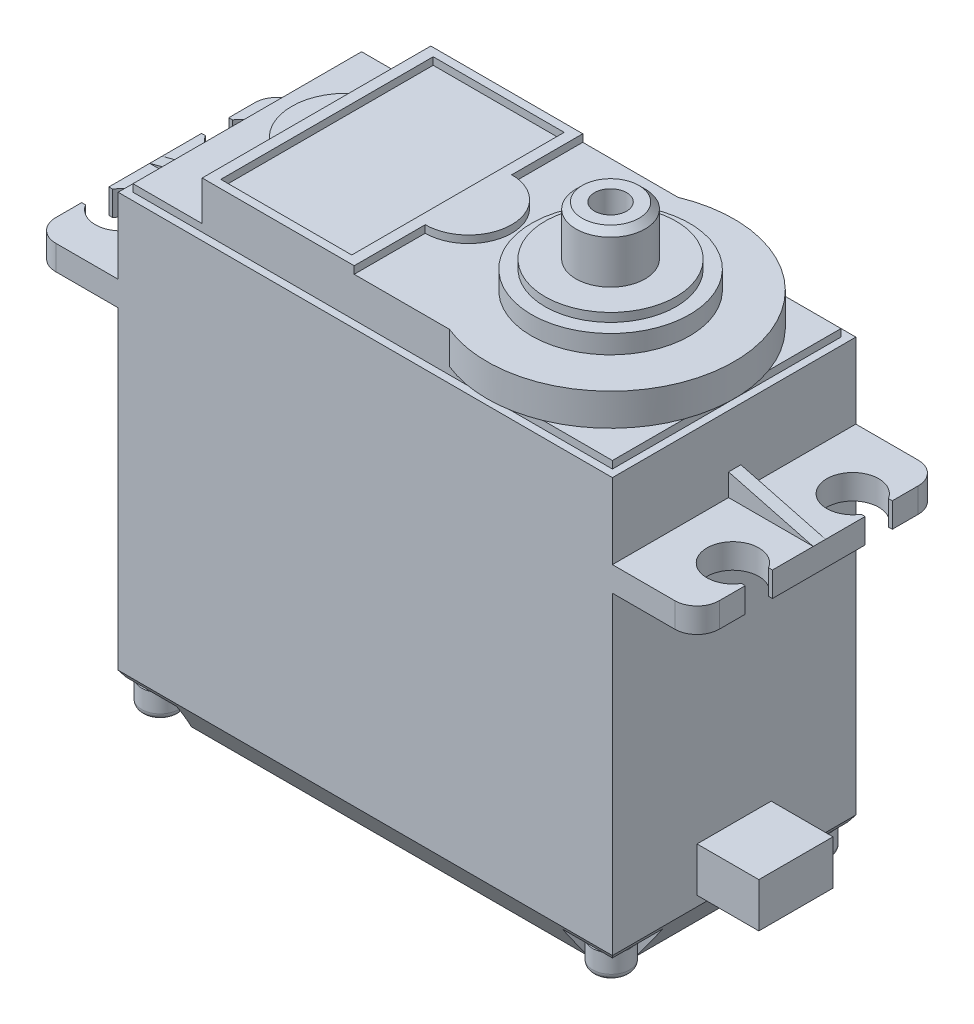
from build123d import *

# Parameters (mm, degrees)
SKETCH1_W            = 40
SKETCH1_H            = 36.5
BOSS_EXTRUDE1_DEPTH  = 19.7
CHAMFER1_SIZE        = 2
CHAMFER1_SIZE2       = 3
CUT_EXTRUDE1_DEPTH   = 2.5
SKETCH4_R            = 1.5
BOSS_EXTRUDE2_DEPTH  = 2
FILLET1_R            = 0.5
FILLET3_R            = 0.5
FILLET4_R            = 0.5
FILLET5_R            = 0.5
SKETCH5_W            = 53.7
SKETCH5_H            = 19.7
BOSS_EXTRUDE3_DEPTH  = 2
CUT_EXTRUDE2_DEPTH   = 2
FILLET9_R            = 1.8
BOSS_EXTRUDE4_DEPTH  = 1
SKETCH8_W            = 38.8
SKETCH8_H            = 18.5
BOSS_EXTRUDE5_DEPTH  = 0.6
BOSS_EXTRUDE6_DEPTH  = 2.6
SKETCH10_W           = 10.6
SKETCH10_H           = 17.190691902
BOSS_EXTRUDE7_DEPTH  = 0.6
SKETCH11_R           = 6.4
BOSS_EXTRUDE8_DEPTH  = 1.5
SKETCH12_R           = 5.3
BOSS_EXTRUDE9_DEPTH  = 0.7
SKETCH13_R           = 2.8
SKETCH13_R_2         = 1.3
BOSS_EXTRUDE10_DEPTH = 4
CHAMFER2_SIZE        = 0.5
CUT_EXTRUDE3_DEPTH   = 1.2
LPATTERN1_COUNT      = 2
LPATTERN1_PITCH      = 36.5
LPATTERN1_COUNT_DIR2 = 2
LPATTERN1_PITCH_DIR2 = 16.3
SKETCH16_W           = 6
SKETCH16_H           = 3.6
BOSS_EXTRUDE11_DEPTH = 5


with BuildPart() as part:
    # Sketch1 → Boss-Extrude1 (new body)
    with BuildSketch(Plane.XY):
        Rectangle(SKETCH1_W, SKETCH1_H)
    extrude(amount=BOSS_EXTRUDE1_DEPTH)

    # Chamfer1
    chamfer1_edges = [part.edges().sort_by_distance(p)[0] for p in [
        (0, -18.25, 19.7),
        (0, -18.25, 0),
        (20, -18.25, 9.85),
        (-20, -18.25, 9.85),
    ]]
    chamfer1_side = [part.faces().sort_by_distance(p)[0] for p in [
        (0, -18.25, 9.85),
    ]]
    chamfer(chamfer1_edges, length=CHAMFER1_SIZE, length2=CHAMFER1_SIZE2, reference=chamfer1_side[0])

    # Sketch2 → Cut-Extrude1 (cut)
    with BuildSketch(Plane.XZ.offset(18.25)):
        with BuildLine():
            Line((20, 15.3), (20, 19.7))
            Line((20, 19.7), (15.6, 19.7))
            ThreePointArc((15.6, 19.7), (16.888730163, 16.588730163), (20, 15.3))
        make_face()
        with BuildLine():
            Line((20, 4.4), (20, 0))
            Line((20, 0), (15.6, 0))
            ThreePointArc((15.6, 0), (16.888730163, 3.111269837), (20, 4.4))
        make_face()
        with BuildLine():
            Line((-15.6, 0), (-20, 0))
            Line((-20, 0), (-20, 4.4))
            ThreePointArc((-20, 4.4), (-16.888730163, 3.111269837), (-15.6, 0))
        make_face()
        with BuildLine():
            Line((-20, 15.3), (-20, 19.7))
            Line((-20, 19.7), (-15.6, 19.7))
            ThreePointArc((-15.6, 19.7), (-16.888730163, 16.588730163), (-20, 15.3))
        make_face()
    extrude(amount=-CUT_EXTRUDE1_DEPTH, mode=Mode.SUBTRACT)

    # Sketch4 → Boss-Extrude2 (add)
    with BuildSketch(Plane.XZ.offset(15.75)):
        with Locations(Location((18.20504142, 18.001219169, 0), (0, 0, 114.453388665))):
            Circle(SKETCH4_R)
        with Locations(Location((18.20504142, 1.751219169, 0), (0, 0, 250.954058998))):
            Circle(SKETCH4_R)
        with Locations(Location((-18.29495858, 1.751219169, 0), (0, 0, 203.869136849))):
            Circle(SKETCH4_R)
        with Locations(Location((-18.29495858, 18.001219169, 0), (0, 0, 156.130863151))):
            Circle(SKETCH4_R)
    extrude(amount=BOSS_EXTRUDE2_DEPTH)

    # Fillet1
    fillet1_edges = [part.edges().sort_by_distance(p)[0] for p in [
        (-16.923250494, -17.75, 17.39424559),
    ]]
    fillet(fillet1_edges, radius=FILLET1_R)

    # Fillet3
    fillet3_edges = [part.edges().sort_by_distance(p)[0] for p in [
        (-16.923250494, -17.75, 2.358192748),
    ]]
    fillet(fillet3_edges, radius=FILLET3_R)

    # Fillet4
    fillet4_edges = [part.edges().sort_by_distance(p)[0] for p in [
        (18.6945307, -17.75, 3.169105006),
    ]]
    fillet(fillet4_edges, radius=FILLET4_R)

    # Fillet5
    fillet5_edges = [part.edges().sort_by_distance(p)[0] for p in [
        (18.825970669, -17.75, 16.635771672),
    ]]
    fillet(fillet5_edges, radius=FILLET5_R)

    # Sketch5 → Boss-Extrude3 (add)
    with BuildSketch(Plane(origin=(0, 10.15, 0), x_dir=(-1, 0, 0), z_dir=(0, -1, 0))):
        with Locations((0, -9.85)):
            Rectangle(SKETCH5_W, SKETCH5_H)
    extrude(amount=-BOSS_EXTRUDE3_DEPTH)

    # Sketch6 → Cut-Extrude2 (cut)
    with BuildSketch(Plane.XZ.offset(-10.15)):
        with BuildLine():
            Line((26.85, 3.9), (26.538854382, 3.9))
            ThreePointArc((26.538854382, 3.9), (22.65, 5), (26.538854382, 6.1))
            Line((26.538854382, 6.1), (26.85, 6.1))
            Line((26.85, 6.1), (26.85, 3.9))
        make_face()
        with BuildLine():
            Line((26.85, 13.6), (26.85, 15.8))
            Line((26.85, 15.8), (26.538854382, 15.8))
            ThreePointArc((26.538854382, 15.8), (22.65, 14.7), (26.538854382, 13.6))
            Line((26.538854382, 13.6), (26.85, 13.6))
        make_face()
        with BuildLine():
            Line((-26.85, 15.8), (-26.538854382, 15.8))
            ThreePointArc((-26.538854382, 15.8), (-22.65, 14.7), (-26.538854382, 13.6))
            Line((-26.538854382, 13.6), (-26.85, 13.6))
            Line((-26.85, 13.6), (-26.85, 15.8))
        make_face()
        with BuildLine():
            Line((-26.85, 6.1), (-26.85, 3.9))
            Line((-26.85, 3.9), (-26.538854382, 3.9))
            ThreePointArc((-26.538854382, 3.9), (-22.65, 5), (-26.538854382, 6.1))
            Line((-26.538854382, 6.1), (-26.85, 6.1))
        make_face()
    extrude(amount=-CUT_EXTRUDE2_DEPTH, mode=Mode.SUBTRACT)

    # Fillet9
    fillet9_edges = [part.edges().sort_by_distance(p)[0] for p in [
        (26.85, 11.15, 0),
        (-26.85, 11.15, 0),
        (-26.85, 11.15, 19.7),
        (26.85, 11.15, 19.7),
    ]]
    fillet(fillet9_edges, radius=FILLET9_R)

    # Sketch7 → Boss-Extrude4 (add)
    with BuildSketch(Plane.XY.offset(10.3)):
        Polygon((-26.85, 12.15), (-20, 13.95), (-20, 12.15), align=None)
        Polygon((20, 12.15), (20, 13.95), (26.85, 12.15), align=None)
    extrude(amount=-BOSS_EXTRUDE4_DEPTH)

    # Sketch8 → Boss-Extrude5 (add)
    with BuildSketch(Plane(origin=(0, 18.25, 0), x_dir=(1, 0, 0), z_dir=(0, 1, 0))):
        with Locations((0, -9.85)):
            Rectangle(SKETCH8_W, SKETCH8_H)
    extrude(amount=BOSS_EXTRUDE5_DEPTH)

    # Sketch9 → Boss-Extrude6 (add)
    with BuildSketch(Plane(origin=(0, 18.85, 0), x_dir=(1, 0, 0), z_dir=(0, 1, 0))):
        with BuildLine():
            Line((-13.799671038, -6.162182217), (-13.799671038, -0.6))
            Line((-13.799671038, -0.6), (6.200328962, -0.6))
            ThreePointArc((6.200328962, -0.6), (20, -9.85), (6.200328962, -19.1))
            Line((6.200328962, -19.1), (-13.799671038, -19.1))
            Line((-13.799671038, -19.1), (-13.799671038, -13.537817783))
            ThreePointArc((-13.799671038, -13.537817783), (-15.799671038, -9.85), (-13.799671038, -6.162182217))
        make_face()
    extrude(amount=BOSS_EXTRUDE6_DEPTH)

    # Sketch10 → Boss-Extrude7 (add)
    with BuildSketch(Plane(origin=(0, 21.45, 0), x_dir=(1, 0, 0), z_dir=(0, 1, 0))):
        with BuildLine():
            Line((-13.799671038, -19.1), (-13.799671038, -0.6))
            Line((-13.799671038, -0.6), (-1.499671038, -0.6))
            Line((-1.499671038, -0.6), (-1.499671038, -6.35))
            ThreePointArc((-1.499671038, -6.35), (2.000328962, -9.85), (-1.499671038, -13.35))
            Line((-1.499671038, -13.35), (-1.499671038, -19.1))
            Line((-1.499671038, -19.1), (-13.799671038, -19.1))
        make_face()
        with Locations((-7.649671038, -9.85)):
            Rectangle(SKETCH10_W, SKETCH10_H, mode=Mode.SUBTRACT)
    extrude(amount=BOSS_EXTRUDE7_DEPTH)

    # Sketch11 → Boss-Extrude8 (add)
    with BuildSketch(Plane(origin=(0, 21.45, 0), x_dir=(1, 0, 0), z_dir=(0, 1, 0))):
        with Locations(Location((10, -9.85, 0), (0, 0, 270))):
            Circle(SKETCH11_R)
    extrude(amount=BOSS_EXTRUDE8_DEPTH)

    # Sketch12 → Boss-Extrude9 (add)
    with BuildSketch(Plane(origin=(0, 22.95, 0), x_dir=(1, 0, 0), z_dir=(0, 1, 0))):
        with Locations(Location((10, -9.85, 0), (0, 0, 270))):
            Circle(SKETCH12_R)
    extrude(amount=BOSS_EXTRUDE9_DEPTH)

    # Sketch13 → Boss-Extrude10 (add)
    with BuildSketch(Plane(origin=(0, 23.65, 0), x_dir=(1, 0, 0), z_dir=(0, 1, 0))):
        with Locations(Location((10, -9.85, 0), (0, 0, 270))):
            Circle(SKETCH13_R)
        with Locations(Location((10, -9.85, 0), (0, 0, 270))):
            Circle(SKETCH13_R_2, mode=Mode.SUBTRACT)
    extrude(amount=BOSS_EXTRUDE10_DEPTH)

    # Chamfer2
    chamfer2_edges = [part.edges().sort_by_distance(p)[0] for p in [
        (10, 27.65, 7.05),
    ]]
    chamfer(chamfer2_edges, length=CHAMFER2_SIZE)

    # Sketch15 → Cut-Extrude3 (cut)
    with BuildSketch(Plane.XZ.offset(17.75)):
        Polygon((18.05504142, 1.601219169), (18.05504142, 0.901219169), (18.35504142, 0.901219169), (18.35504142, 1.601219169), (19.05504142, 1.601219169), (19.05504142, 1.901219169), (18.35504142, 1.901219169), (18.35504142, 2.601219169), (18.05504142, 2.601219169), (18.05504142, 1.901219169), (17.35504142, 1.901219169), (17.35504142, 1.601219169), align=None)
    cut_extrude3 = extrude(amount=-CUT_EXTRUDE3_DEPTH, mode=Mode.SUBTRACT)

    # LPattern1: Cut-Extrude3 2 × 2
    with Locations(*[(-i * LPATTERN1_PITCH, 0, j * LPATTERN1_PITCH_DIR2) for i in range(LPATTERN1_COUNT) for j in range(LPATTERN1_COUNT_DIR2) if (i, j) != (0, 0)]):
        add(cut_extrude3, mode=Mode.SUBTRACT)

    # Sketch16 → Boss-Extrude11 (add)
    with BuildSketch(Plane(origin=(20, 0, 0), x_dir=(0, 0, -1), z_dir=(1, 0, 0))):
        with Locations((-9.85, -12.65)):
            Rectangle(SKETCH16_W, SKETCH16_H)
    extrude(amount=BOSS_EXTRUDE11_DEPTH)


solid = part.part
